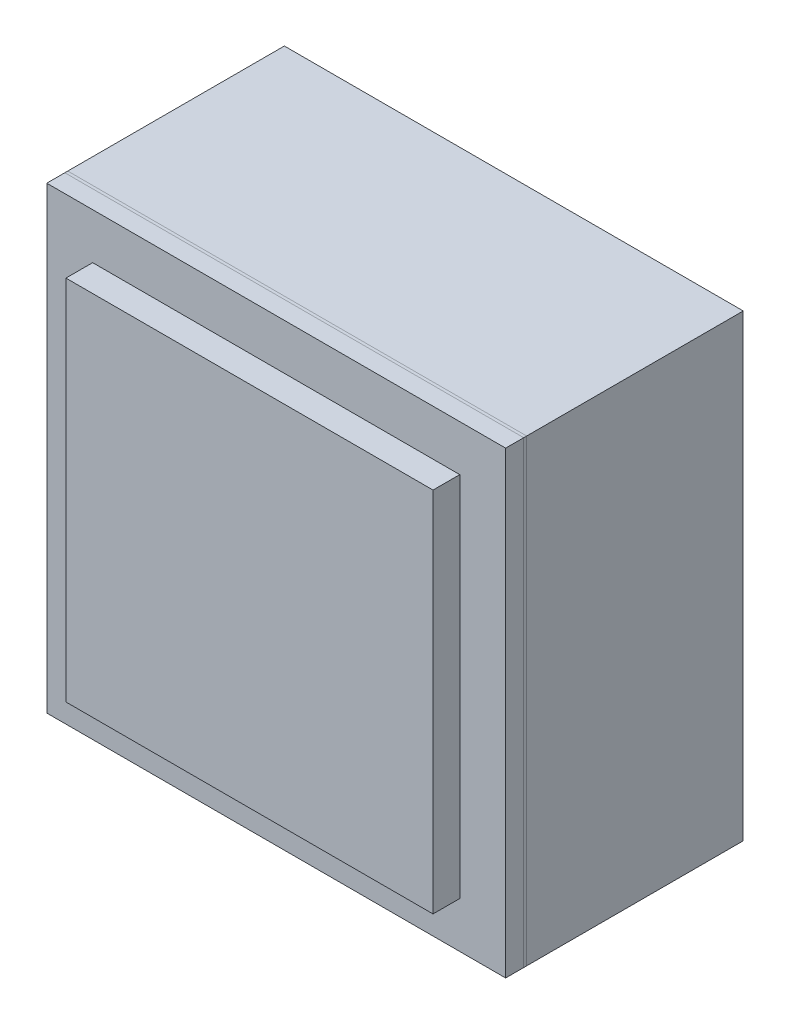
from build123d import *

# Parameters (mm, degrees)
SKETCH1_W           = 14.986
SKETCH1_H           = 31.75
BOSS_EXTRUDE1_DEPTH = 15.875
BOSS_EXTRUDE2_DEPTH = 15.875
SKETCH1_6_W         = 0.2032
SKETCH1_6_H         = 31.75
BOSS_EXTRUDE4_DEPTH = 15.875
SKETCH1_7_W         = 1.8488
SKETCH1_7_H         = 25.4
BOSS_EXTRUDE5_DEPTH = 12.7


with BuildPart() as part:
    # Sketch1 → Boss-Extrude1 (new, symmetric)
    with BuildSketch(Plane(origin=(0, 0, 0), x_dir=(0, 0, -1), z_dir=(1, 0, 0))):
        Rectangle(SKETCH1_W, SKETCH1_H)
    extrude(amount=BOSS_EXTRUDE1_DEPTH, both=True)


with BuildPart() as body_2:
    # Sketch1<3> → Boss-Extrude2 (new, symmetric)
    with BuildSketch(Plane(origin=(0, 0, 0), x_dir=(0, 0, -1), z_dir=(1, 0, 0))):
        Polygon((-7.6962, -15.875), (-7.6962, 15.875), (-8.9462, 15.875), (-8.9462, 12.7), (-8.9462, -12.7), (-8.9462, -15.875), align=None)
    extrude(amount=BOSS_EXTRUDE2_DEPTH, both=True)


with BuildPart() as body_3:
    # Sketch1<6> → Boss-Extrude4 (new, symmetric)
    with BuildSketch(Plane(origin=(0, 0, 0), x_dir=(0, 0, -1), z_dir=(1, 0, 0))):
        with Locations((-7.5946, 0)):
            Rectangle(SKETCH1_6_W, SKETCH1_6_H)
    extrude(amount=BOSS_EXTRUDE4_DEPTH, both=True)


with BuildPart() as body_4:
    # Sketch1<7> → Boss-Extrude5 (new, symmetric)
    with BuildSketch(Plane(origin=(0, 0, 0), x_dir=(0, 0, -1), z_dir=(1, 0, 0))):
        with Locations((-9.8706, 0)):
            Rectangle(SKETCH1_7_W, SKETCH1_7_H)
    extrude(amount=BOSS_EXTRUDE5_DEPTH, both=True)


solid = Compound([part.part, body_2.part, body_3.part, body_4.part])
